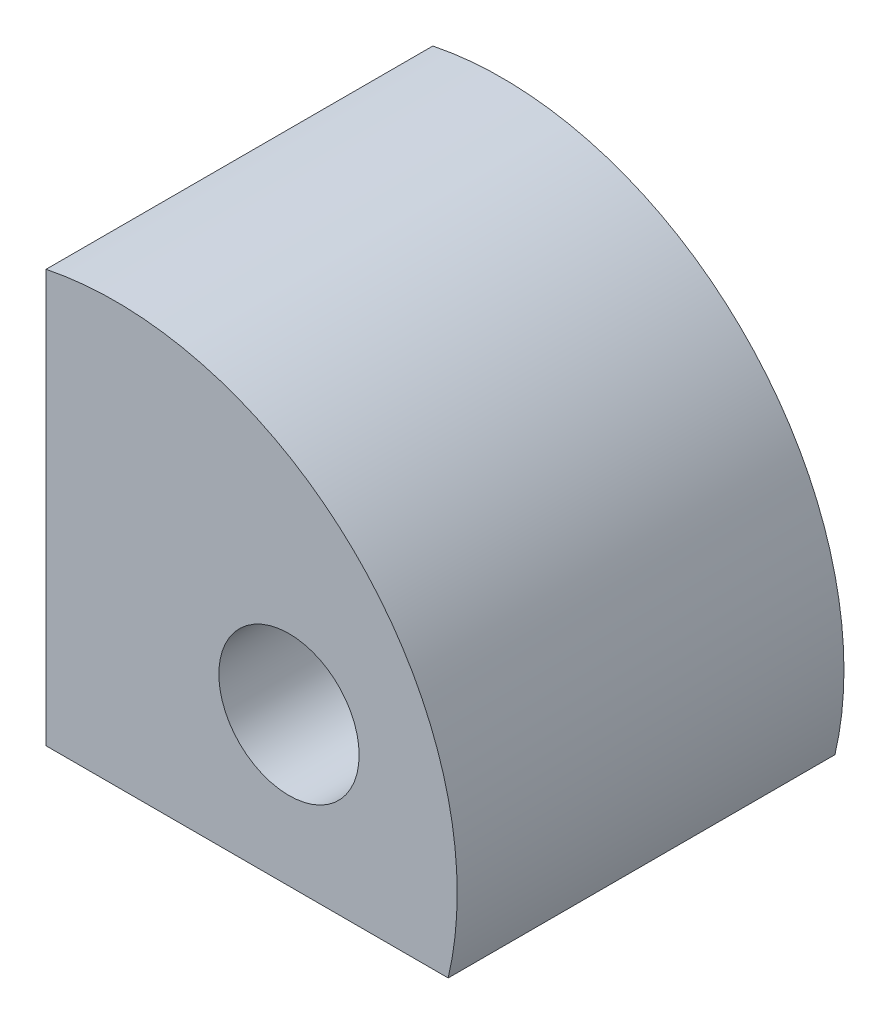
from build123d import *

# Parameters (mm, degrees)
SKETCH1_R           = 1.7
BOSS_EXTRUDE1_DEPTH = 9.373333333


with BuildPart() as part:
    # Sketch1 → Boss-Extrude1 (new body)
    with BuildSketch(Plane.XY):
        with BuildLine():
            Line((6.852535078, -4.74904773), (-2.89418708, -4.74904773))
            Line((-2.89418708, -4.74904773), (-2.89418708, 5.252191919))
            ThreePointArc((-2.89418708, 5.252191919), (4.718655654, 2.921337792), (6.852535078, -4.74904773))
        make_face()
        with Locations((2.993724275, -1.14904773)):
            Circle(SKETCH1_R, mode=Mode.SUBTRACT)
    extrude(amount=BOSS_EXTRUDE1_DEPTH)


solid = part.part
